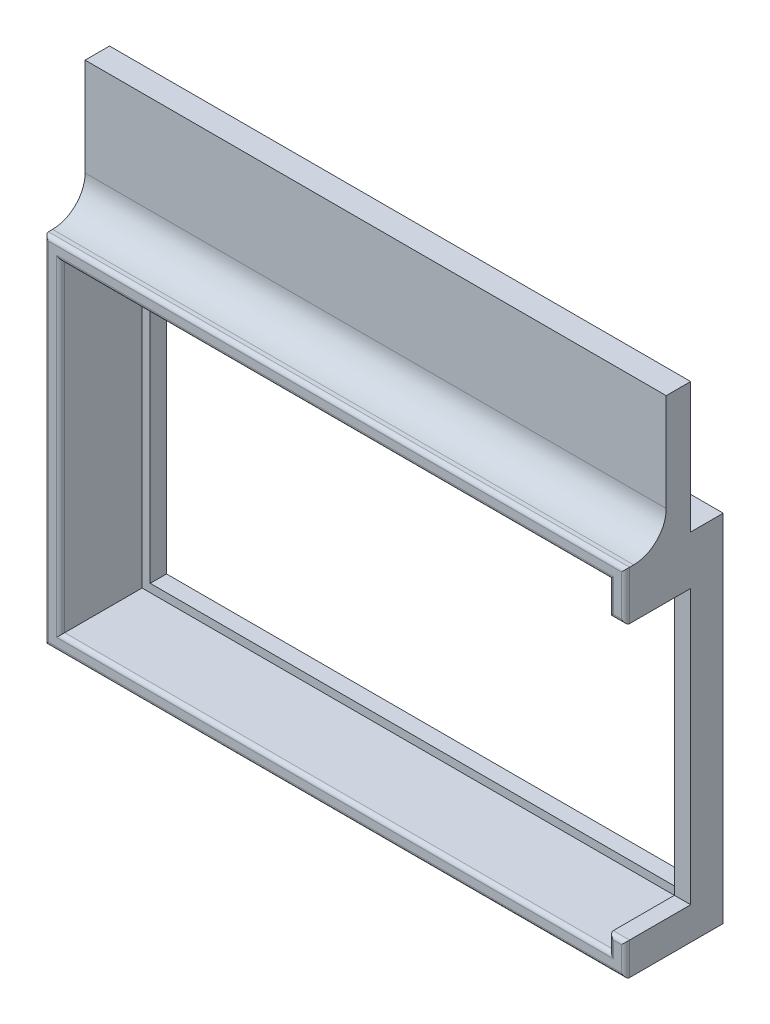
from build123d import *

# Parameters (mm, degrees)
ESQUISSE1_W              = 35.68
ESQUISSE1_H              = 21.82
BOSS_EXTRU_1_DEPTH       = 6
ESQUISSE2_W              = 33.68
ESQUISSE2_H              = 19.82
ENL_V_MAT_EXTRU_1_DEPTH  = 5
ESQUISSE3_W              = 32.68
ESQUISSE3_H              = 18.82
ENL_V_MAT_EXTRU_2_DEPTH  = 43.120954405
ESQUISSE4_W              = 4
ESQUISSE4_H              = 16.82
ENL_V_MAT_EXTRU_3_DEPTH  = 5
ESQUISSE6_W              = 35.68
ESQUISSE6_H              = 8
BOSS_EXTRU_2_DEPTH       = 4
ESQUISSE7_W              = 35.68
ESQUISSE7_H              = 8
ENL_V_MAT_EXTRU_12_DEPTH = 2.5
CONG_1_R                 = 2
CONG_2_R                 = 0.25


with BuildPart() as part:
    # Esquisse1 → Boss.-Extru.1 (new body)
    with BuildSketch(Plane.XY):
        with Locations((17.84, 10.91)):
            Rectangle(ESQUISSE1_W, ESQUISSE1_H)
    extrude(amount=BOSS_EXTRU_1_DEPTH)

    # Esquisse2 → Enlèv. mat.-Extru.1 (cut)
    with BuildSketch(Plane.XY.offset(6)):
        with Locations((17.84, 10.91)):
            Rectangle(ESQUISSE2_W, ESQUISSE2_H)
    extrude(amount=-ENL_V_MAT_EXTRU_1_DEPTH, mode=Mode.SUBTRACT)

    # Esquisse3 → Enlèv. mat.-Extru.2 (cut, through all)
    with BuildSketch(Plane.XY.offset(1)):
        with Locations((17.84, 10.91)):
            Rectangle(ESQUISSE3_W, ESQUISSE3_H)
    extrude(amount=-ENL_V_MAT_EXTRU_2_DEPTH, mode=Mode.SUBTRACT)

    # Esquisse4 → Enlèv. mat.-Extru.3 (cut)
    with BuildSketch(Plane(origin=(35.68, 0, 0), x_dir=(0, 0, -1), z_dir=(1, 0, 0))):
        with Locations((-4, 10.41)):
            Rectangle(ESQUISSE4_W, ESQUISSE4_H)
    extrude(amount=-ENL_V_MAT_EXTRU_3_DEPTH, mode=Mode.SUBTRACT)

    # Esquisse6 → Boss.-Extru.2 (add)
    with BuildSketch(Plane.XY.offset(6)):
        with Locations((17.84, 25.82)):
            Rectangle(ESQUISSE6_W, ESQUISSE6_H)
    extrude(amount=-BOSS_EXTRU_2_DEPTH)

    # Esquisse7 → Enlèv. mat.-Extru.12 (cut)
    with BuildSketch(Plane.XY.offset(6)):
        with Locations((17.84, 25.82)):
            Rectangle(ESQUISSE7_W, ESQUISSE7_H)
    extrude(amount=-ENL_V_MAT_EXTRU_12_DEPTH, mode=Mode.SUBTRACT)

    # Congé1
    cong_1_edges = [part.edges().sort_by_distance(p)[0] for p in [
        (17.84, 21.82, 3.5),
    ]]
    fillet(cong_1_edges, radius=CONG_1_R)

    # Congé2
    cong_2_edges = [part.edges().sort_by_distance(p)[0] for p in [
        (35.68, 1, 6),
        (1, 10.91, 6),
        (17.84, 1, 6),
        (34.68, 1.5, 6),
        (17.84, 20.82, 6),
        (34.68, 19.82, 6),
        (35.68, 20.32, 6),
        (35.18, 2, 6),
        (35.18, 18.82, 6),
        (17.84, 0, 6),
        (0, 10.91, 6),
        (17.84, 21.82, 6),
    ]]
    fillet(cong_2_edges, radius=CONG_2_R)


solid = part.part
